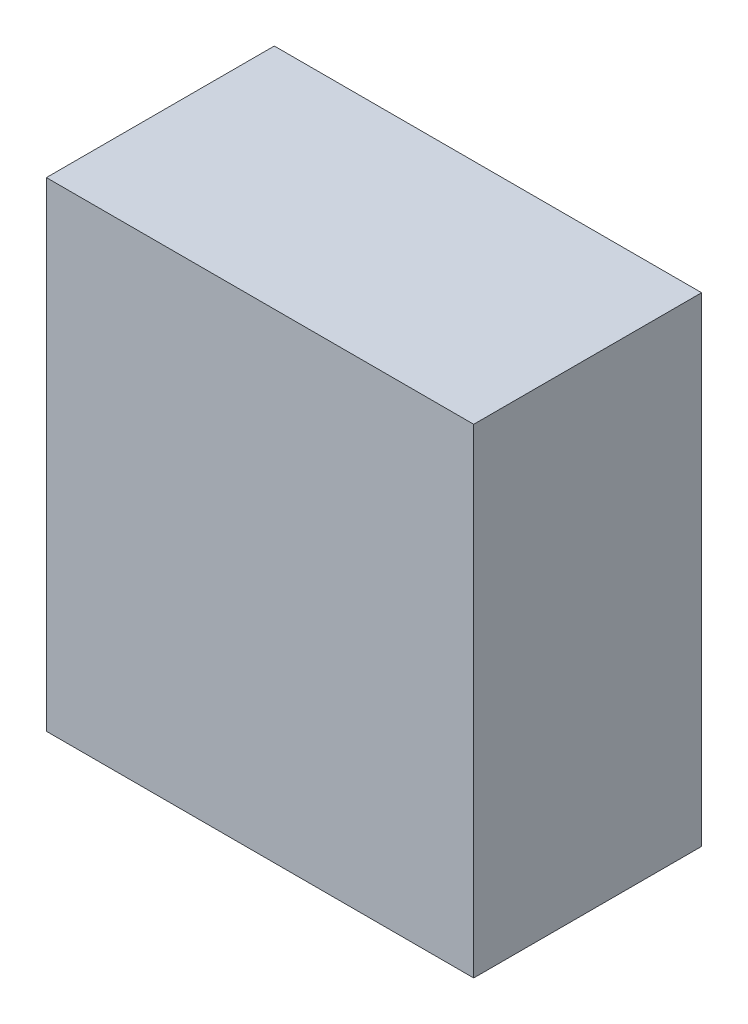
from build123d import *

# Parameters (mm, degrees)
SKETCH1_W           = 9
SKETCH1_H           = 10.1
BOSS_EXTRUDE1_DEPTH = 4.8


with BuildPart() as part:
    # Sketch1 → Boss-Extrude1 (new body)
    with BuildSketch(Plane.XY):
        Rectangle(SKETCH1_W, SKETCH1_H)
    extrude(amount=BOSS_EXTRUDE1_DEPTH)


solid = part.part
